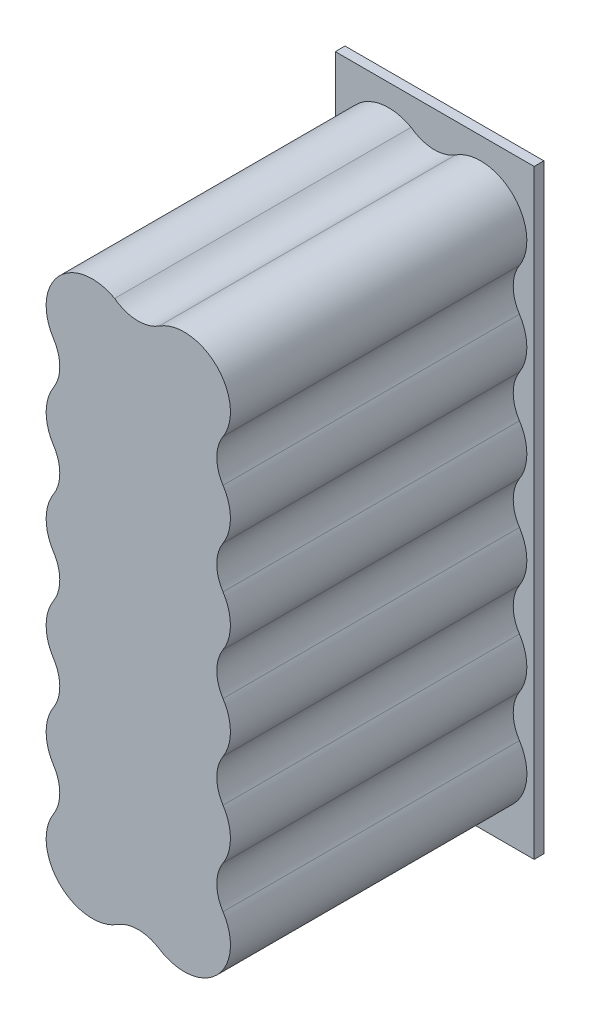
from build123d import *

# Parameters (mm, degrees)
EXTRUDE1_DEPTH = 61
SKETCH2_W      = 40.918085351
SKETCH2_H      = 123.5
EXTRUDE6_DEPTH = 2


with BuildPart() as part:
    # Sketch1 → Extrude1 (new body)
    with BuildSketch(Plane.XY):
        with BuildLine():
            ThreePointArc((18.117441581, 18.278729708), (16.836042019, 22.621586851), (18.117441581, 26.964443994))
            ThreePointArc((18.117441581, 26.964443994), (16.856617983, 38.839101272), (4.981960705, 40.09992487))
            ThreePointArc((4.981960705, 40.09992487), (0.344560099, 38.823949387), (-4.1863741, 40.437713029))
            ThreePointArc((-4.1863741, 40.437713029), (-15.67064328, 38.66031776), (-16.842423207, 27.098548676))
            ThreePointArc((-16.842423207, 27.098548676), (-15.474586856, 22.702284028), (-16.756389299, 18.280168965))
            ThreePointArc((-16.756389299, 18.280168965), (-18.278642652, 13.201858254), (-16.842423207, 8.098548676))
            ThreePointArc((-16.842423207, 8.098548676), (-15.474586856, 3.702284028), (-16.756389299, -0.719831035))
            ThreePointArc((-16.756389299, -0.719831035), (-18.278642652, -5.798141746), (-16.842423207, -10.901451324))
            ThreePointArc((-16.842423207, -10.901451324), (-15.474586856, -15.297715972), (-16.756389299, -19.719831035))
            ThreePointArc((-16.756389299, -19.719831035), (-18.278642652, -24.798141746), (-16.842423207, -29.901451324))
            ThreePointArc((-16.842423207, -29.901451324), (-15.474586856, -34.297715972), (-16.756389299, -38.719831035))
            ThreePointArc((-16.756389299, -38.719831035), (-18.278642652, -43.798141746), (-16.842423207, -48.901451324))
            ThreePointArc((-16.842423207, -48.901451324), (-15.474586856, -53.297715972), (-16.756389299, -57.719831035))
            ThreePointArc((-16.756389299, -57.719831035), (-15.510318105, -69.582077178), (-3.653305695, -70.877003311))
            ThreePointArc((-3.653305695, -70.877003311), (0.671232667, -69.612662366), (4.993176556, -70.885843854))
            ThreePointArc((4.993176556, -70.885843854), (16.87201709, -69.603985894), (18.117441581, -57.721270292))
            ThreePointArc((18.117441581, -57.721270292), (16.836042019, -53.378413149), (18.117441581, -49.035556006))
            ThreePointArc((18.117441581, -49.035556006), (19.639103562, -43.878413149), (18.117441581, -38.721270292))
            ThreePointArc((18.117441581, -38.721270292), (16.836042019, -34.378413149), (18.117441581, -30.035556006))
            ThreePointArc((18.117441581, -30.035556006), (19.639103562, -24.878413149), (18.117441581, -19.721270292))
            ThreePointArc((18.117441581, -19.721270292), (16.836042019, -15.378413149), (18.117441581, -11.035556006))
            ThreePointArc((18.117441581, -11.035556006), (19.639103562, -5.878413149), (18.117441581, -0.721270292))
            ThreePointArc((18.117441581, -0.721270292), (16.836042019, 3.621586851), (18.117441581, 7.964443994))
            ThreePointArc((18.117441581, 7.964443994), (19.639103562, 13.121586851), (18.117441581, 18.278729708))
        make_face()
    extrude(amount=EXTRUDE1_DEPTH)

    # Sketch2 → Extrude6 (add)
    with BuildSketch(Plane(origin=(0, 0, 0), x_dir=(-1, 0, 0), z_dir=(0, 0, -1))):
        with Locations((-0.680060887, -15.628413149)):
            Rectangle(SKETCH2_W, SKETCH2_H)
    extrude(amount=EXTRUDE6_DEPTH)


solid = part.part
